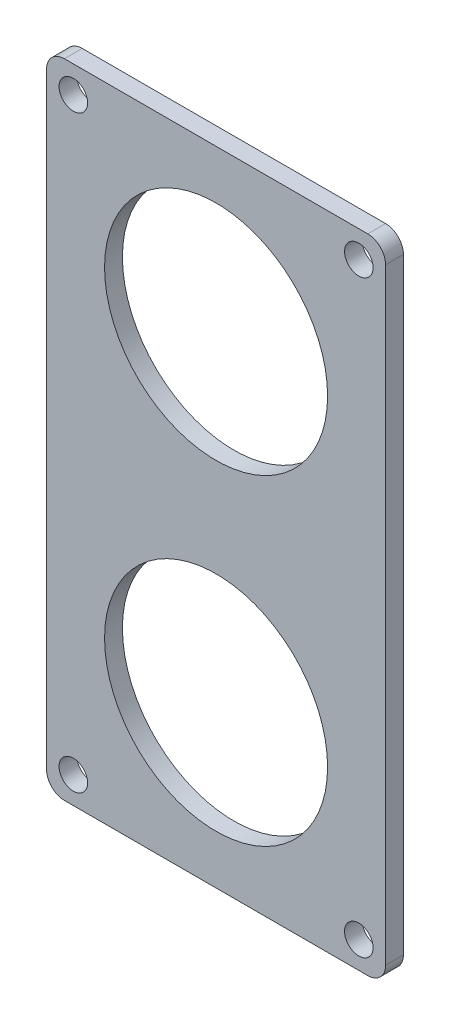
from build123d import *

# Parameters (mm, degrees)
SKETCH1_W           = 38
SKETCH1_H           = 72
SKETCH1_R           = 1.6
BOSS_EXTRUDE1_DEPTH = 2
SKETCH2_R           = 12.5
CUT_EXTRUDE1_DEPTH  = 59.075295953
FILLET2_R           = 2


with BuildPart() as part:
    # Sketch1 → Boss-Extrude1 (new body)
    with BuildSketch(Plane.XY):
        with Locations((1.5, 18.3)):
            Rectangle(SKETCH1_W, SKETCH1_H)
        with Locations((17.5, -14.7)):
            Circle(SKETCH1_R, mode=Mode.SUBTRACT)
        with Locations((-14.5, -14.7)):
            Circle(SKETCH1_R, mode=Mode.SUBTRACT)
        with Locations((17.5, 51.3)):
            Circle(SKETCH1_R, mode=Mode.SUBTRACT)
        with Locations((-14.5, 51.3)):
            Circle(SKETCH1_R, mode=Mode.SUBTRACT)
    extrude(amount=BOSS_EXTRUDE1_DEPTH)

    # Sketch2 → Cut-Extrude1 (cut, through all)
    with BuildSketch(Plane.XY.offset(2)):
        with Locations((1.5, 0.3)):
            Circle(SKETCH2_R)
        with Locations((1.5, 36.3)):
            Circle(SKETCH2_R)
    extrude(amount=-CUT_EXTRUDE1_DEPTH, mode=Mode.SUBTRACT)

    # Fillet2
    fillet2_edges = [part.edges().sort_by_distance(p)[0] for p in [
        (20.5, -17.7, 1),
        (-17.5, -17.7, 1),
        (-17.5, 54.3, 1),
        (20.5, 54.3, 1),
    ]]
    fillet(fillet2_edges, radius=FILLET2_R)


solid = part.part
